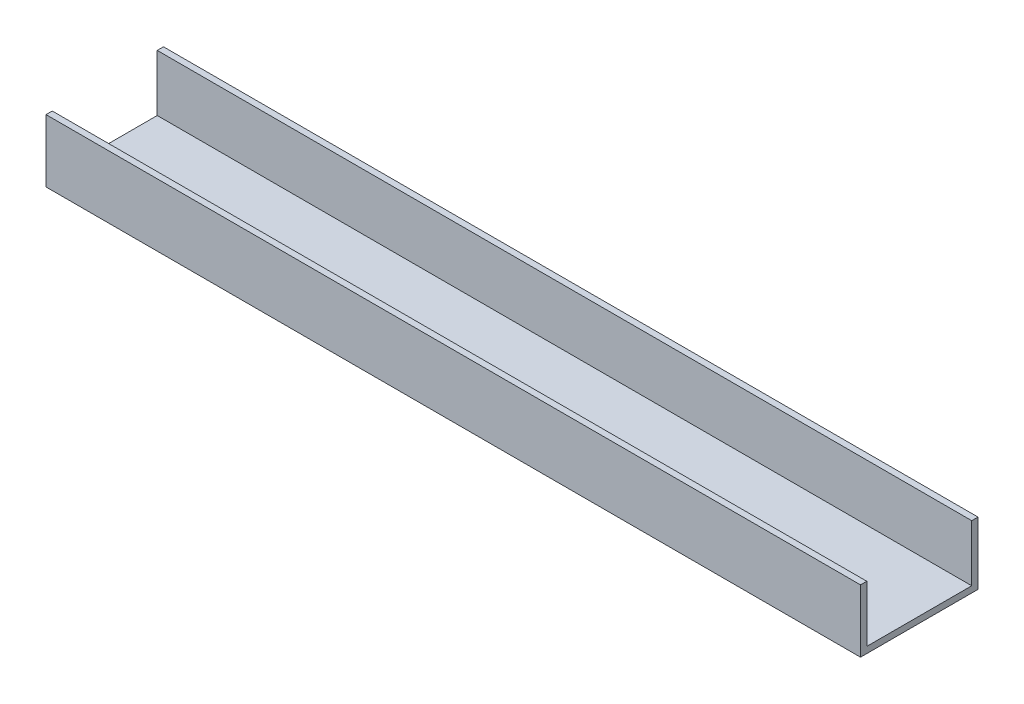
from build123d import *

# Parameters (mm, degrees)
SKETCH_1_W      = 520
SKETCH_1_H      = 75
EXTRUDE_1_DEPTH = 4
SKETCH_2_W      = 520
SKETCH_2_H      = 4
EXTRUDE_2_DEPTH = 36


with BuildPart() as part:
    # 스케치1 → 보스-돌출1 (new body)
    with BuildSketch(Plane(origin=(0, 0, 0), x_dir=(1, 0, 0), z_dir=(0, 1, 0))):
        with Locations((260, 37.5)):
            Rectangle(SKETCH_1_W, SKETCH_1_H)
    extrude(amount=EXTRUDE_1_DEPTH)

    # 스케치2 → 보스-돌출2 (add)
    with BuildSketch(Plane(origin=(0, 4, 0), x_dir=(1, 0, 0), z_dir=(0, 1, 0))):
        with Locations((260, 2)):
            Rectangle(SKETCH_2_W, SKETCH_2_H)
        with Locations((260, 73)):
            Rectangle(SKETCH_2_W, SKETCH_2_H)
    extrude(amount=EXTRUDE_2_DEPTH)


solid = part.part
